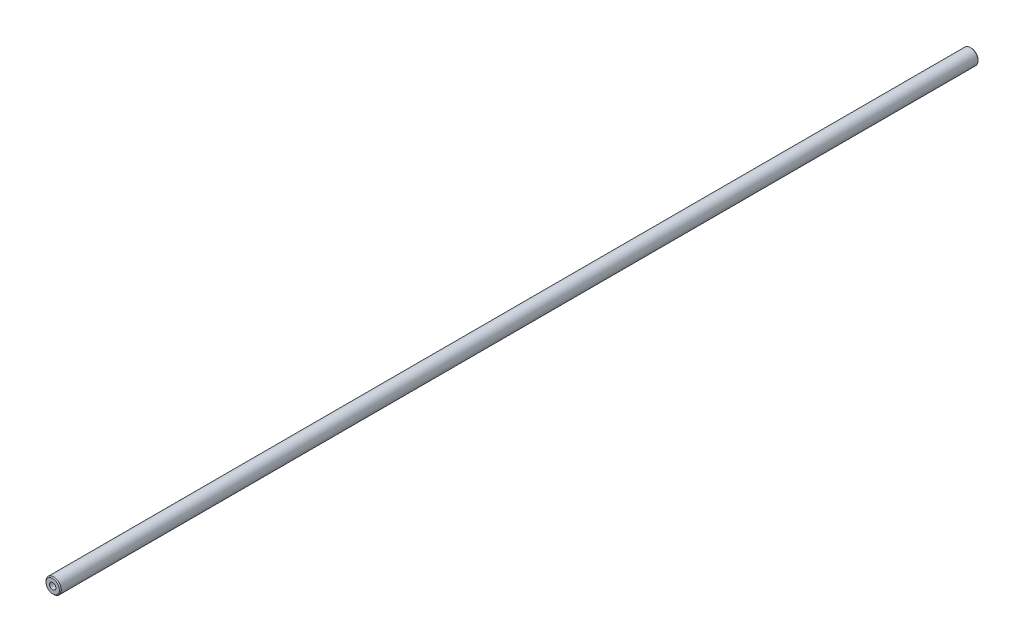
from build123d import *

# Parameters (mm, degrees)
ESQUISSE1_R           = 4
BOSS_EXTRU_1_DEPTH    = 480
CHANFREIN1_SIZE       = 0.5
TROU_TARAUD_M41_D     = 3.3
TROU_TARAUD_M41_DEPTH = 11.5
TROU_TARAUD_M41_TIP   = 0.991420021
TROU_TARAUD_M42_D     = 3.3
TROU_TARAUD_M42_DEPTH = 11.5
TROU_TARAUD_M42_TIP   = 0.991420021


with BuildPart() as part:
    # Esquisse1 → Boss.-Extru.1 (new body)
    with BuildSketch(Plane.XY):
        Circle(ESQUISSE1_R)
    extrude(amount=BOSS_EXTRU_1_DEPTH)

    # Chanfrein1
    chanfrein1_edges = [part.edges().sort_by_distance(p)[0] for p in [
        (-4, 0, 0),
        (-4, 0, 480),
    ]]
    chamfer(chanfrein1_edges, length=CHANFREIN1_SIZE)

    # Trou taraudé M41
    with Locations(Plane.XY.offset(480)):
        with Locations((0, 0)):
            Hole(TROU_TARAUD_M41_D / 2, depth=TROU_TARAUD_M41_DEPTH)
            with Locations((0, 0, -(TROU_TARAUD_M41_DEPTH + TROU_TARAUD_M41_TIP / 2))):  # 118° drill point
                Cone(0, TROU_TARAUD_M41_D / 2, TROU_TARAUD_M41_TIP, mode=Mode.SUBTRACT)

    # Trou taraudé M42
    with Locations(Plane(origin=(0, 0, 0), x_dir=(-1, 0, 0), z_dir=(0, 0, -1))):
        with Locations((0, 0)):
            Hole(TROU_TARAUD_M42_D / 2, depth=TROU_TARAUD_M42_DEPTH)
            with Locations((0, 0, -(TROU_TARAUD_M42_DEPTH + TROU_TARAUD_M42_TIP / 2))):  # 118° drill point
                Cone(0, TROU_TARAUD_M42_D / 2, TROU_TARAUD_M42_TIP, mode=Mode.SUBTRACT)


solid = part.part
